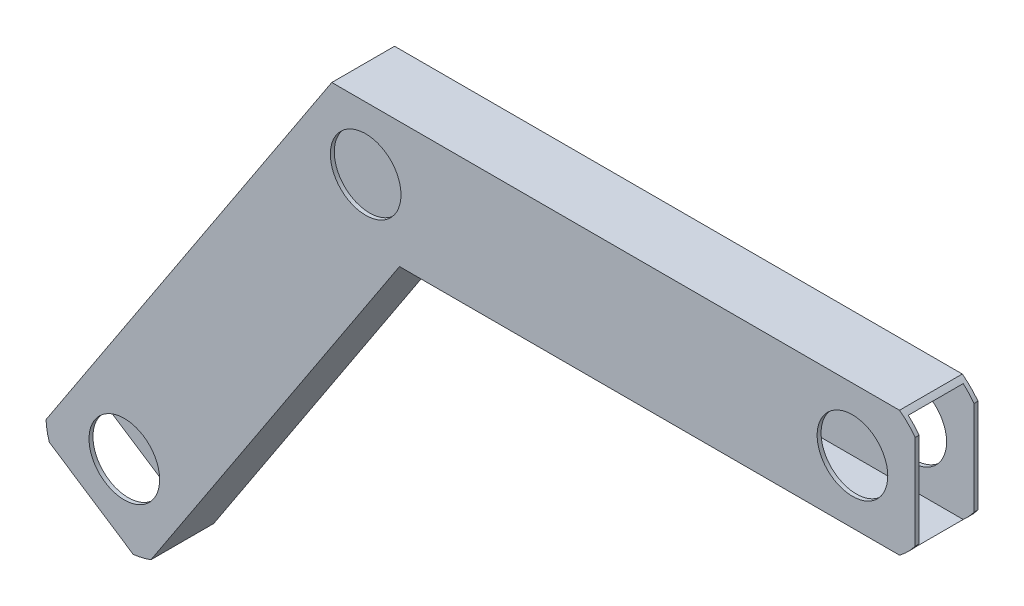
from build123d import *

# Parameters (mm, degrees)
BOSS_EXTRUDE2_DEPTH = 25.4
SHELL1_T            = -1.5875
SKETCH4_W           = 47.625
SKETCH4_H           = 22.225
CUT_EXTRUDE1_DEPTH  = 25.4
SKETCH5_R           = 14.2875
CUT_EXTRUDE2_DEPTH  = 268.575466435
CUT_EXTRUDE4_DEPTH  = 25.4


with BuildPart() as part:
    # Sketch3 → Boss-Extrude2 (new body)
    with BuildSketch(Plane.XY):
        Polygon((117.084839529, 87.84302106), (-118.985491202, 87.84302106), (-237.562751028, -92.579381795), (-195.110420945, -120.479913519), (-91.583155779, 37.04302106), (117.084839529, 37.04302106), align=None)
    extrude(amount=BOSS_EXTRUDE2_DEPTH)

    # Shell1
    shell1_openings = [part.faces().sort_by_distance(p)[0] for p in [
        (117.084839529, 62.44302106, 12.7),
    ]]
    offset(amount=SHELL1_T, openings=shell1_openings, kind=Kind.INTERSECTION)

    # Sketch4 → Cut-Extrude1 (cut)
    with BuildSketch(Plane(origin=(-114.151230572, -173.687934254, 0), x_dir=(0.8356757890471017, -0.549223065430162, 0), z_dir=(-0.549223065430162, -0.8356757890471017, 0))):
        with Locations((-122.278707548, 12.7)):
            Rectangle(SKETCH4_W, SKETCH4_H)
    extrude(amount=-CUT_EXTRUDE1_DEPTH, mode=Mode.SUBTRACT)

    # Sketch5 → Cut-Extrude2 (cut, through all)
    with BuildSketch(Plane.XY):
        with Locations((-202.936184524, -86.140134233)):
            Circle(SKETCH5_R)
        with Locations((91.684839529, 62.44302106)):
            Circle(SKETCH5_R)
        with Locations((-105.28432349, 62.44302106)):
            Circle(SKETCH5_R)
    extrude(amount=CUT_EXTRUDE2_DEPTH, mode=Mode.SUBTRACT)

    # Sketch6 → Cut-Extrude4 (cut)
    with BuildSketch(Plane.XY.offset(25.4)):
        with BuildLine():
            Line((117.084839529, 81.49302106), (117.084839529, 87.84302106))
            Line((117.084839529, 87.84302106), (110.734839529, 87.84302106))
            ThreePointArc((110.734839529, 87.84302106), (114.135479832, 84.893661363), (117.084839529, 81.49302106))
        make_face()
        with BuildLine():
            Line((117.084839529, 37.04302106), (117.084839529, 43.39302106))
            ThreePointArc((117.084839529, 43.39302106), (114.135479832, 39.992380757), (110.734839529, 37.04302106))
            Line((110.734839529, 37.04302106), (117.084839529, 37.04302106))
        make_face()
        with BuildLine():
            ThreePointArc((-233.314578978, -95.371366566), (-234.181501959, -91.778630344), (-234.625048962, -88.109492152))
            Line((-234.625048962, -88.109492152), (-237.562751028, -92.579381795))
            Line((-237.562751028, -92.579381795), (-233.314578978, -95.371366566))
        make_face()
        with BuildLine():
            Line((-195.110420945, -120.479913519), (-192.172718878, -116.010023876))
            ThreePointArc((-192.172718878, -116.010023876), (-195.716744004, -117.058448847), (-199.358592995, -117.687928749))
            Line((-199.358592995, -117.687928749), (-195.110420945, -120.479913519))
        make_face()
    extrude(amount=-CUT_EXTRUDE4_DEPTH, mode=Mode.SUBTRACT)


solid = part.part
